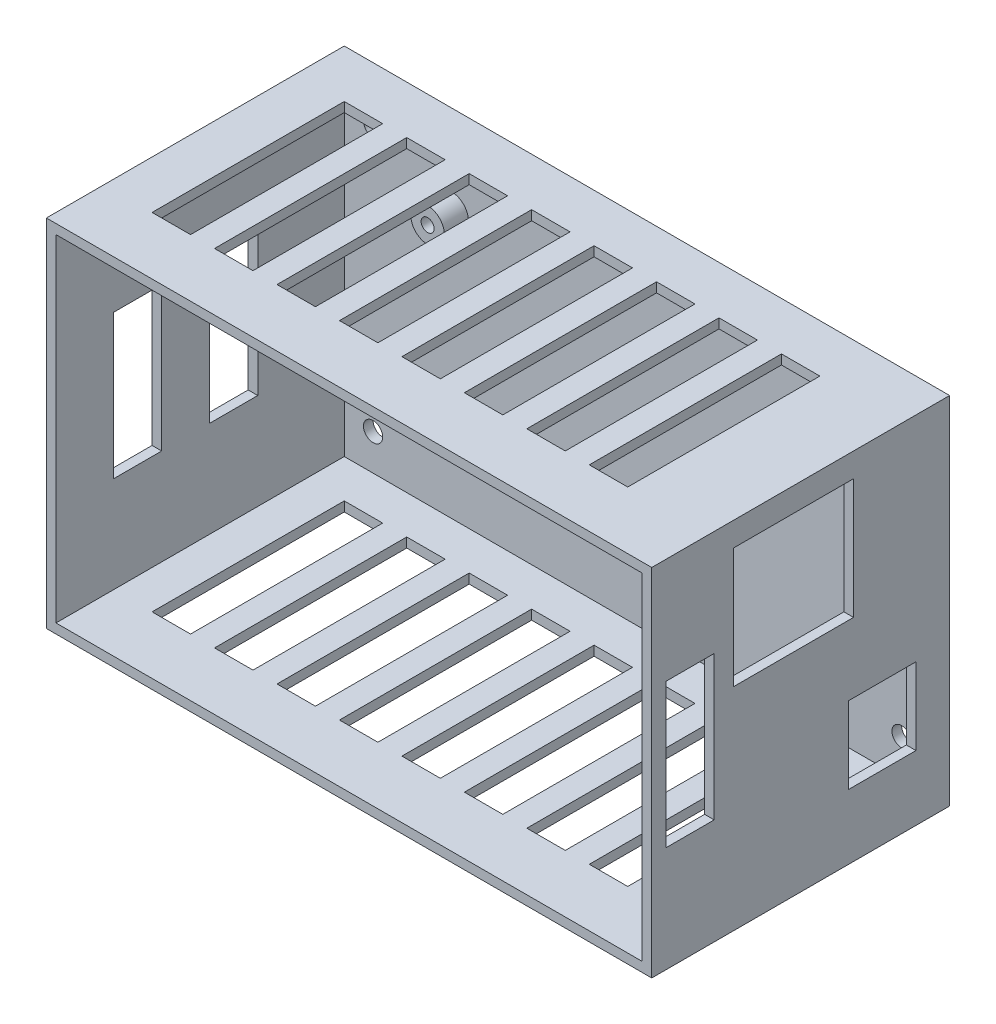
from build123d import *

# Parameters (mm, degrees)
ESBO_O1_W                = 126
ESBO_O1_H                = 74
ESBO_O1_W_2              = 122
ESBO_O1_H_2              = 70
RESSALTO_EXTRUS_O1_DEPTH = 60
ESBO_O2_W                = 126
ESBO_O2_H                = 74
ESBO_O2_R                = 2
RESSALTO_EXTRUS_O2_DEPTH = 2
ESBO_O3_W                = 25
ESBO_O3_H                = 25
ESBO_O3_W_2              = 14
ESBO_O3_H_2              = 16
ESBO_O3_W_3              = 10
ESBO_O3_H_3              = 30
CORTE_EXTRUS_O1_DEPTH    = 10
ESBO_O6_W                = 8
ESBO_O6_H                = 40
CORTE_EXTRUS_O2_DEPTH    = 115.214710086
ESBO_O7_W                = 10
ESBO_O7_H                = 30
CORTE_EXTRUS_O3_DEPTH    = 12
ESBO_O8_R                = 3.5
ESBO_O8_R_2              = 1.35
RESSALTO_EXTRUS_O3_DEPTH = 5


with BuildPart() as part:
    # Esboço1 → Ressalto-extrusão1 (new body)
    with BuildSketch(Plane.XY):
        Rectangle(ESBO_O1_W, ESBO_O1_H)
        Rectangle(ESBO_O1_W_2, ESBO_O1_H_2, mode=Mode.SUBTRACT)
    extrude(amount=RESSALTO_EXTRUS_O1_DEPTH)

    # Esboço2 → Ressalto-extrusão2 (add)
    with BuildSketch(Plane(origin=(0, 0, 0), x_dir=(-1, 0, 0), z_dir=(0, 0, -1))):
        Rectangle(ESBO_O2_W, ESBO_O2_H)
        with Locations((-55, -27.5)):
            Circle(ESBO_O2_R, mode=Mode.SUBTRACT)
        with Locations((55, -27.5)):
            Circle(ESBO_O2_R, mode=Mode.SUBTRACT)
        with Locations((55, 27.5)):
            Circle(ESBO_O2_R, mode=Mode.SUBTRACT)
        with Locations((-55, 27.5)):
            Circle(ESBO_O2_R, mode=Mode.SUBTRACT)
    extrude(amount=RESSALTO_EXTRUS_O2_DEPTH)

    # Esboço3 → Corte-extrusão1 (cut)
    with BuildSketch(Plane(origin=(63, 0, 0), x_dir=(0, 0, -1), z_dir=(1, 0, 0))):
        with Locations((-30.5, 19.5)):
            Rectangle(ESBO_O3_W, ESBO_O3_H)
        with Locations((-12, -15.5)):
            Rectangle(ESBO_O3_W_2, ESBO_O3_H_2)
        with Locations((-52, 0)):
            Rectangle(ESBO_O3_W_3, ESBO_O3_H_3)
    extrude(amount=-CORTE_EXTRUS_O1_DEPTH, mode=Mode.SUBTRACT)

    # Esboço6 → Corte-extrusão2 (cut, through all)
    with BuildSketch(Plane.XZ.offset(37)):
        with Locations((-49, 28)):
            Rectangle(ESBO_O6_W, ESBO_O6_H)
        with Locations((-36, 28)):
            Rectangle(ESBO_O6_W, ESBO_O6_H)
        with Locations((-23, 28)):
            Rectangle(ESBO_O6_W, ESBO_O6_H)
        with Locations((-10, 28)):
            Rectangle(ESBO_O6_W, ESBO_O6_H)
        with Locations((3, 28)):
            Rectangle(ESBO_O6_W, ESBO_O6_H)
        with Locations((16, 28)):
            Rectangle(ESBO_O6_W, ESBO_O6_H)
        with Locations((29, 28)):
            Rectangle(ESBO_O6_W, ESBO_O6_H)
        with Locations((42, 28)):
            Rectangle(ESBO_O6_W, ESBO_O6_H)
    extrude(amount=-CORTE_EXTRUS_O2_DEPTH, mode=Mode.SUBTRACT)

    # Esboço7 → Corte-extrusão3 (cut)
    with BuildSketch(Plane.ZY.offset(63)):
        with Locations((43, 0)):
            Rectangle(ESBO_O7_W, ESBO_O7_H)
        with Locations((23, 0)):
            Rectangle(ESBO_O7_W, ESBO_O7_H)
    extrude(amount=-CORTE_EXTRUS_O3_DEPTH, mode=Mode.SUBTRACT)

    # Esboço8 → Ressalto-extrusão3 (add)
    # profile 1 of 3: a face of its own
    with BuildSketch(Plane.XY):
        with Locations((-38.65, 20.4)):
            Circle(ESBO_O8_R)
        with Locations((-38.65, 20.4)):
            Circle(ESBO_O8_R_2, mode=Mode.SUBTRACT)
    # profile 2 of 3: a face of its own
    with BuildSketch(Plane.XY):
        with Locations((40.257399983, -26.445189119)):
            Circle(ESBO_O8_R)
        with Locations((40.257399983, -26.445189119)):
            Circle(ESBO_O8_R_2, mode=Mode.SUBTRACT)
    # profile 3 of 3: a face of its own
    with BuildSketch(Plane.XY):
        with Locations((41.55, 20.6)):
            Circle(ESBO_O8_R)
        with Locations((41.55, 20.6)):
            Circle(ESBO_O8_R_2, mode=Mode.SUBTRACT)
    extrude(amount=RESSALTO_EXTRUS_O3_DEPTH)


solid = part.part
